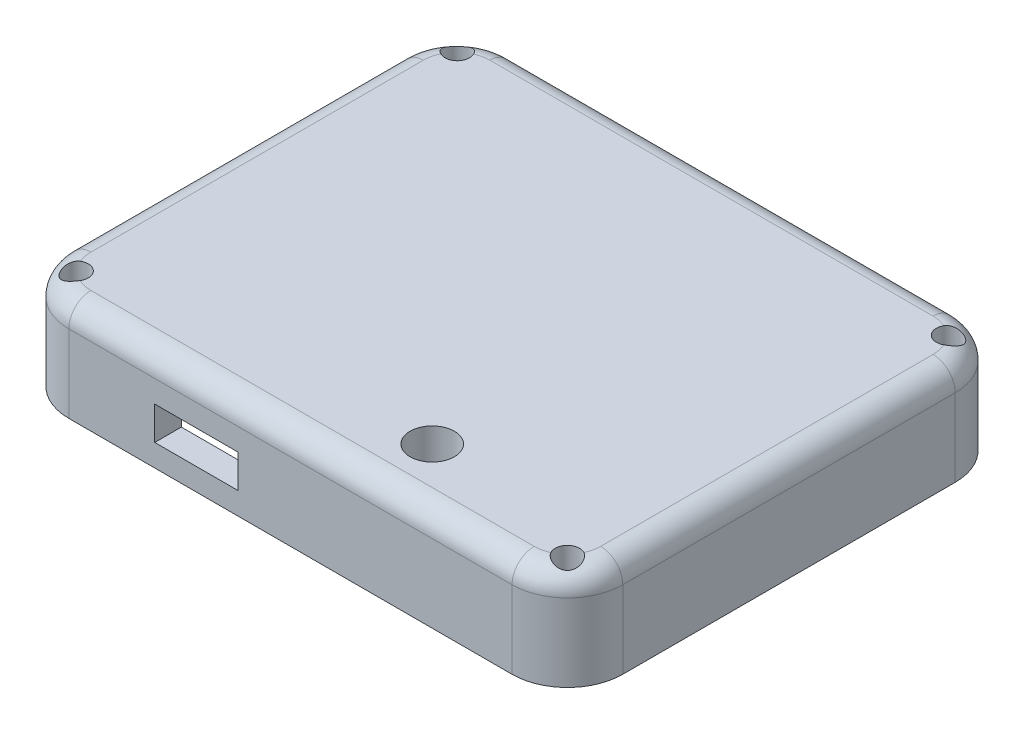
from build123d import *

# Parameters (mm, degrees)
BOSS_EXTRUDE1_DEPTH = 9
FILLET1_R           = 2
CUT_EXTRUDE1_DEPTH  = 7
SKETCH3_R           = 1.1
CUT_EXTRUDE2_DEPTH  = 44.38862164
SKETCH4_R           = 1.5
BOSS_EXTRUDE2_DEPTH = 6
SKETCH5_R           = 1.1
CUT_EXTRUDE3_DEPTH  = 5
SKETCH7_R           = 1.21715418
BOSS_EXTRUDE3_DEPTH = 3
SKETCH8_W           = 16
SKETCH8_H           = 21
CUT_EXTRUDE4_DEPTH  = 3
SKETCH9_R           = 2
CUT_EXTRUDE5_DEPTH  = 54.392249766
SKETCH10_R          = 2.5
BOSS_EXTRUDE4_DEPTH = 2
SKETCH11_R          = 2
CUT_EXTRUDE6_DEPTH  = 43.738419489
SKETCH14_R          = 1.1
BOSS_EXTRUDE5_DEPTH = 3.5
SKETCH15_W          = 19
SKETCH15_H          = 15
CUT_EXTRUDE7_DEPTH  = 3.5
SKETCH16_W          = 1.21715418
SKETCH16_H          = 16.846199199
CUT_EXTRUDE8_DEPTH  = 3.5
SKETCH17_W          = 7.5
SKETCH17_H          = 3
CUT_EXTRUDE9_DEPTH  = 2.4


with BuildPart() as part:
    # Sketch1 → Boss-Extrude1 (new body)
    with BuildSketch(Plane(origin=(0, 0, 0), x_dir=(1, 0, 0), z_dir=(0, 1, 0))):
        with BuildLine():
            Line((-31.823529412, 18.890756303), (8.176470588, 18.890756303))
            ThreePointArc((8.176470588, 18.890756303), (11.712004494, 17.426290208), (13.176470588, 13.890756303))
            Line((13.176470588, 13.890756303), (13.176470588, -16.109243697))
            ThreePointArc((13.176470588, -16.109243697), (11.712004494, -19.644777603), (8.176470588, -21.109243697))
            Line((8.176470588, -21.109243697), (-31.823529412, -21.109243697))
            ThreePointArc((-31.823529412, -21.109243697), (-35.359063318, -19.644777603), (-36.823529412, -16.109243697))
            Line((-36.823529412, -16.109243697), (-36.823529412, 13.890756303))
            ThreePointArc((-36.823529412, 13.890756303), (-35.359063318, 17.426290208), (-31.823529412, 18.890756303))
        make_face()
    extrude(amount=BOSS_EXTRUDE1_DEPTH)

    # Fillet1
    fillet1_edges = [part.edges().sort_by_distance(p)[0] for p in [
        (11.712004494, 9, -17.426290208),
        (-11.823529412, 9, -18.890756303),
        (-35.359063318, 9, -17.426290208),
        (-36.823529412, 9, 1.109243697),
        (-35.359063318, 9, 19.644777603),
        (-11.823529412, 9, 21.109243697),
        (11.712004494, 9, 19.644777603),
        (13.176470588, 9, 1.109243697),
    ]]
    fillet(fillet1_edges, radius=FILLET1_R)

    # Sketch2 → Cut-Extrude1 (cut)
    with BuildSketch(Plane.XZ):
        with BuildLine():
            Line((-29.423529412, 18.709243697), (5.776470588, 18.709243697))
            ThreePointArc((5.776470588, 18.709243697), (9.312004494, 17.244777603), (10.776470588, 13.709243697))
            Line((10.776470588, 13.709243697), (10.776470588, -11.490756303))
            ThreePointArc((10.776470588, -11.490756303), (9.312004494, -15.026290208), (5.776470588, -16.490756303))
            Line((5.776470588, -16.490756303), (-29.423529412, -16.490756303))
            ThreePointArc((-29.423529412, -16.490756303), (-32.959063318, -15.026290208), (-34.423529412, -11.490756303))
            Line((-34.423529412, -11.490756303), (-34.423529412, 13.709243697))
            ThreePointArc((-34.423529412, 13.709243697), (-32.959063318, 17.244777603), (-29.423529412, 18.709243697))
        make_face()
    extrude(amount=-CUT_EXTRUDE1_DEPTH, mode=Mode.SUBTRACT)

    # Sketch3 → Cut-Extrude2 (cut, through all)
    with BuildSketch(Plane.XZ):
        with Locations(Location((10.376470588, 18.309243697, 0), (0, 0, 270))):
            Circle(SKETCH3_R)
        with Locations(Location((-34.023484676, 18.246215417, 0), (0, 0, 270))):
            Circle(SKETCH3_R)
        with Locations(Location((-34.023484676, -16.153784583, 0), (0, 0, 270))):
            Circle(SKETCH3_R)
        with Locations(Location((10.376470588, -16.090756303, 0), (0, 0, 270))):
            Circle(SKETCH3_R)
    extrude(amount=-CUT_EXTRUDE2_DEPTH, mode=Mode.SUBTRACT)

    # Sketch4 → Boss-Extrude2 (add)
    with BuildSketch(Plane.XZ.offset(-7)):
        with Locations(Location((6.201470588, 15.859243697, 0), (0, 0, 270))):
            Circle(SKETCH4_R)
        with Locations(Location((-30.298529412, 15.859243697, 0), (0, 0, 270))):
            Circle(SKETCH4_R)
        with Locations(Location((-30.298529412, -13.640756303, 0), (0, 0, 270))):
            Circle(SKETCH4_R)
        with Locations(Location((6.201470588, -13.640756303, 0), (0, 0, 270))):
            Circle(SKETCH4_R)
    extrude(amount=BOSS_EXTRUDE2_DEPTH)

    # Sketch5 → Cut-Extrude3 (cut)
    with BuildSketch(Plane.XZ.offset(-1)):
        with Locations(Location((6.201470588, 15.859243697, 0), (0, 0, 270))):
            Circle(SKETCH5_R)
        with Locations(Location((-30.298529412, 15.859243697, 0), (0, 0, 270))):
            Circle(SKETCH5_R)
        with Locations(Location((-30.298529412, -13.640756303, 0), (0, 0, 270))):
            Circle(SKETCH5_R)
        with Locations(Location((6.201470588, -13.640756303, 0), (0, 0, 270))):
            Circle(SKETCH5_R)
    extrude(amount=-CUT_EXTRUDE3_DEPTH, mode=Mode.SUBTRACT)

    # Sketch7 → Boss-Extrude3 (add)
    with BuildSketch(Plane(origin=(0, 7, 0), x_dir=(-1, 0, 0), z_dir=(0, -1, 0))):
        with Locations(Location((-4.201470588, -10.859243697, 0), (0, 0, 90))):
            Circle(SKETCH7_R)
        with Locations(Location((11.798529412, -10.859243697, 0), (0, 0, 90))):
            Circle(SKETCH7_R)
        with Locations(Location((11.798529412, 10.140756303, 0), (0, 0, 90))):
            Circle(SKETCH7_R)
        with Locations(Location((-4.201470588, 10.140756303, 0), (0, 0, 90))):
            Circle(SKETCH7_R)
    extrude(amount=BOSS_EXTRUDE3_DEPTH)

    # Sketch8 → Cut-Extrude4 (cut)
    with BuildSketch(Plane.XZ.offset(-4)):
        with Locations((-3.798529412, 0.359243697)):
            Rectangle(SKETCH8_W, SKETCH8_H)
    extrude(amount=-CUT_EXTRUDE4_DEPTH, mode=Mode.SUBTRACT)

    # Sketch9 → Cut-Extrude5 (cut, through all)
    with BuildSketch(Plane.XY.offset(-16.490756303)):
        with Locations((-24.423529412, 4)):
            Circle(SKETCH9_R)
    extrude(amount=-CUT_EXTRUDE5_DEPTH, mode=Mode.SUBTRACT)

    # Sketch10 → Boss-Extrude4 (add)
    with BuildSketch(Plane.XZ.offset(-7)):
        with Locations(Location((-4.423529412, 15.709243697, 0), (0, 0, 270))):
            Circle(SKETCH10_R)
    extrude(amount=BOSS_EXTRUDE4_DEPTH)

    # Sketch11 → Cut-Extrude6 (cut, through all)
    with BuildSketch(Plane.XZ.offset(-5)):
        with Locations(Location((-4.423529412, 15.709243697, 0), (0, 0, 270))):
            Circle(SKETCH11_R)
    extrude(amount=-CUT_EXTRUDE6_DEPTH, mode=Mode.SUBTRACT)

    # Sketch14 → Boss-Extrude5 (add)
    with BuildSketch(Plane(origin=(0, 7, 0), x_dir=(-1, 0, 0), z_dir=(0, -1, 0))):
        with Locations(Location((31.798529412, -10.859243697, 0), (0, 0, 90))):
            Circle(SKETCH14_R)
        with Locations(Location((31.798529412, 4.140756303, 0), (0, 0, 90))):
            Circle(SKETCH14_R)
        with Locations(Location((12.498529412, 4.140756303, 0), (0, 0, 90))):
            Circle(SKETCH14_R)
    extrude(amount=BOSS_EXTRUDE5_DEPTH)

    # Sketch15 → Cut-Extrude7 (cut)
    with BuildSketch(Plane.XZ.offset(-3.5)):
        with Locations((-22.298529412, 3.359243697)):
            Rectangle(SKETCH15_W, SKETCH15_H)
    extrude(amount=-CUT_EXTRUDE7_DEPTH, mode=Mode.SUBTRACT)

    # Sketch16 → Cut-Extrude8 (cut)
    with BuildSketch(Plane.XZ.offset(-3.5)):
        with Locations((-11.189952322, 2.436144097)):
            Rectangle(SKETCH16_W, SKETCH16_H)
    extrude(amount=-CUT_EXTRUDE8_DEPTH, mode=Mode.SUBTRACT)

    # Sketch17 → Cut-Extrude9 (cut)
    with BuildSketch(Plane.XY.offset(21.109243697)):
        with Locations((-20.316797715, 3.5)):
            Rectangle(SKETCH17_W, SKETCH17_H)
    extrude(amount=-CUT_EXTRUDE9_DEPTH, mode=Mode.SUBTRACT)


solid = part.part
